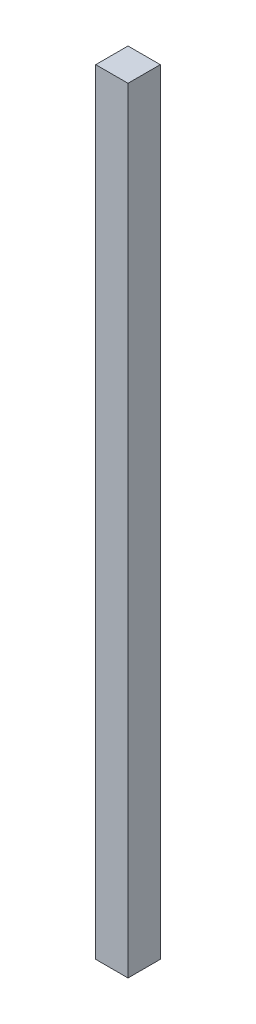
from build123d import *

# Parameters (mm, degrees)
SKETCH1_W           = 101.6
SKETCH1_H           = 101.6
BOSS_EXTRUDE1_DEPTH = 2438.4


with BuildPart() as part:
    # Sketch1 → Boss-Extrude1 (new body)
    with BuildSketch(Plane(origin=(0, 0, 0), x_dir=(1, 0, 0), z_dir=(0, 1, 0))):
        Rectangle(SKETCH1_W, SKETCH1_H)
    extrude(amount=BOSS_EXTRUDE1_DEPTH)


solid = part.part
